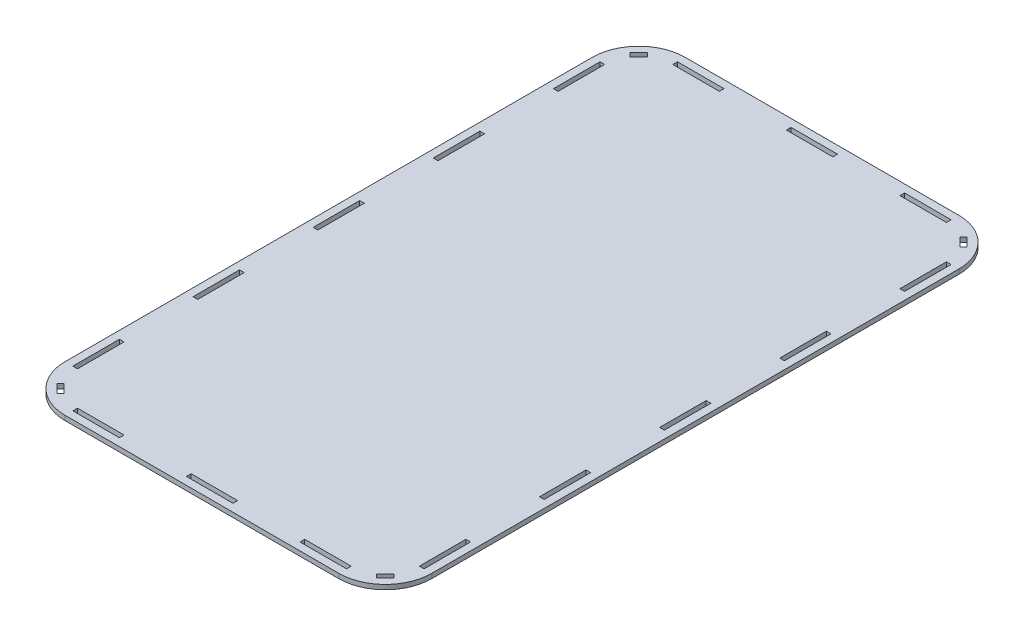
from build123d import *

# Parameters (mm, degrees)
SKETCH1_W           = 236.5
SKETCH1_H           = 400
BOSS_EXTRUDE1_DEPTH = 1.5
FILLET1_R           = 30
SKETCH2_W           = 3
SKETCH2_H           = 30
CUT_EXTRUDE1_DEPTH  = 233.361921364
SKETCH3_W           = 30
SKETCH3_H           = 3
CUT_EXTRUDE2_DEPTH  = 233.361921364
CUT_EXTRUDE3_DEPTH  = 233.361921364


with BuildPart() as part:
    # Sketch1 → Boss-Extrude1 (new, symmetric)
    with BuildSketch(Plane(origin=(0, 0, 0), x_dir=(1, 0, 0), z_dir=(0, 1, 0))):
        Rectangle(SKETCH1_W, SKETCH1_H)
    extrude(amount=BOSS_EXTRUDE1_DEPTH, both=True)

    # Fillet1
    fillet1_edges = [part.edges().sort_by_distance(p)[0] for p in [
        (118.25, 0, 200),
        (-118.25, 0, 200),
        (-118.25, 0, -200),
        (118.25, 0, -200),
    ]]
    fillet(fillet1_edges, radius=FILLET1_R)

    # Sketch2 → Cut-Extrude1 (cut, through all)
    with BuildSketch(Plane(origin=(0, 1.5, 0), x_dir=(1, 0, 0), z_dir=(0, 1, 0))):
        with Locations((-111.75, -155)):
            Rectangle(SKETCH2_W, SKETCH2_H)
        with Locations((-111.75, -77.5)):
            Rectangle(SKETCH2_W, SKETCH2_H)
        with Locations((-111.75, 0)):
            Rectangle(SKETCH2_W, SKETCH2_H)
        with Locations((-111.75, 77.5)):
            Rectangle(SKETCH2_W, SKETCH2_H)
        with Locations((-111.75, 155)):
            Rectangle(SKETCH2_W, SKETCH2_H)
    cut_extrude1 = extrude(amount=-CUT_EXTRUDE1_DEPTH, mode=Mode.SUBTRACT)

    # Sketch3 → Cut-Extrude2 (cut, through all)
    with BuildSketch(Plane(origin=(0, 1.5, 0), x_dir=(1, 0, 0), z_dir=(0, 1, 0))):
        with Locations((-73.25, 193.5)):
            Rectangle(SKETCH3_W, SKETCH3_H)
        with Locations((0, 193.5)):
            Rectangle(SKETCH3_W, SKETCH3_H)
        with Locations((73.25, 193.5)):
            Rectangle(SKETCH3_W, SKETCH3_H)
    cut_extrude2 = extrude(amount=-CUT_EXTRUDE2_DEPTH, mode=Mode.SUBTRACT)

    # Mirror1: Cut-Extrude2 across plane
    add(cut_extrude2.mirror(Plane.XY), mode=Mode.SUBTRACT)

    # Mirror2: Cut-Extrude1 across plane
    add(cut_extrude1.mirror(Plane(origin=(0, 0, 0), x_dir=(0, 0, 1), z_dir=(1, 0, 0))), mode=Mode.SUBTRACT)

    # Sketch4 → Cut-Extrude3 (cut, through all)
    with BuildSketch(Plane(origin=(0, 1.5, 0), x_dir=(1, 0, 0), z_dir=(0, 1, 0))):
        Polygon((-108.756096654, 184.849242405), (-103.099242405, 190.506096654), (-100.718631416, 188.125485666), (-106.375485666, 182.468631416), align=None)
        Polygon((100.718631416, 188.125485666), (106.375485666, 182.468631416), (108.756096654, 184.849242405), (103.099242405, 190.506096654), align=None)
        Polygon((103.099242405, -190.506096654), (100.718631416, -188.125485666), (106.375485666, -182.468631416), (108.756096654, -184.849242405), align=None)
        Polygon((-100.718631416, -188.125485666), (-106.375485666, -182.468631416), (-108.756096654, -184.849242405), (-103.099242405, -190.506096654), align=None)
    extrude(amount=-CUT_EXTRUDE3_DEPTH, mode=Mode.SUBTRACT)


solid = part.part
